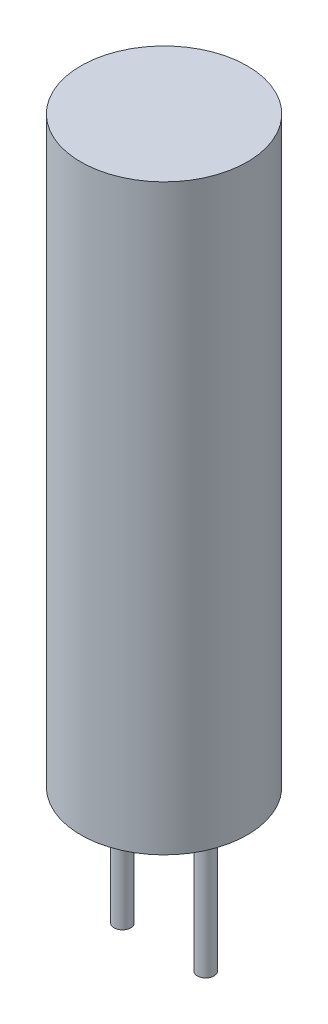
from build123d import *

# Parameters (mm, degrees)
SK_ELECTRODE_PINS_R    = 0.6
ELECTRODE_PINS_DEPTH   = 10
ELECTRODE_PINS_2_DEPTH = 10
PROBE_START            = 10
SK_PROBE_BODY_R        = 6
PROBE_BODY_DEPTH       = 42


with BuildPart() as part:
    # SK Electrode pins → Electrode pins (new body)
    with BuildSketch(Plane(origin=(0, 0, 0), x_dir=(1, 0, 0), z_dir=(0, 1, 0))):
        with Locations((-3, 0)):
            Circle(SK_ELECTRODE_PINS_R)
    extrude(amount=ELECTRODE_PINS_DEPTH)


with BuildPart() as body_2:
    # SK Electrode pins → Electrode pins 2 (new body)
    with BuildSketch(Plane(origin=(0, 0, 0), x_dir=(1, 0, 0), z_dir=(0, 1, 0))):
        with Locations((3, 0)):
            Circle(SK_ELECTRODE_PINS_R)
    extrude(amount=ELECTRODE_PINS_2_DEPTH)


with BuildPart() as body_3:
    # SK Probe body → Probe body (new body)
    with BuildSketch(Plane(origin=(0, 0, 0), x_dir=(1, 0, 0), z_dir=(0, 1, 0)).offset(PROBE_START)):
        Circle(SK_PROBE_BODY_R)
    extrude(amount=PROBE_BODY_DEPTH)


solid = Compound([part.part, body_2.part, body_3.part])
